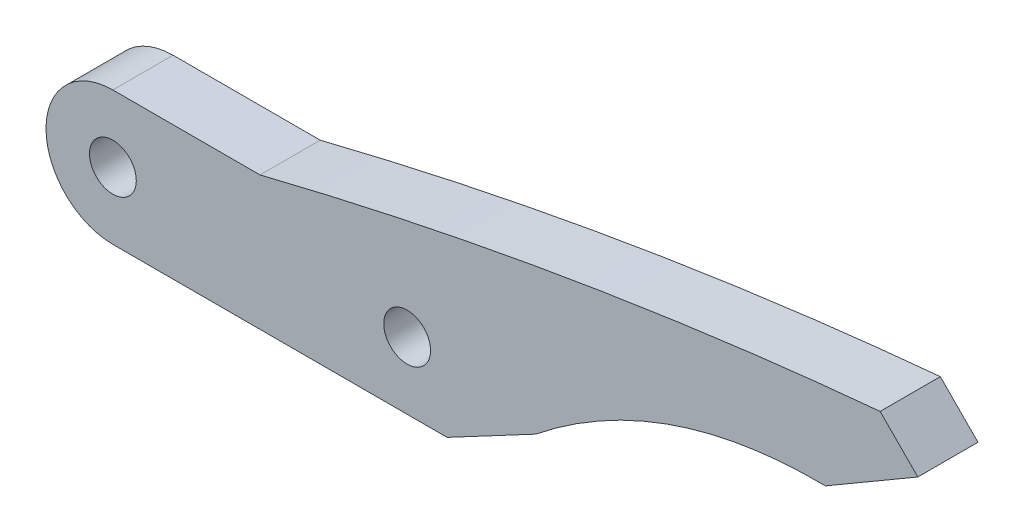
from build123d import *

# Parameters (mm, degrees)
SKETCH1_R           = 5
SKETCH1_R_2         = 1.75
BOSS_EXTRUDE1_DEPTH = 4.5
BOSS_EXTRUDE2_START = -4.5
BOSS_EXTRUDE2_DEPTH = 4.5


with BuildPart() as part:
    # Sketch1 → Boss-Extrude1 (new body)
    # profile 1 of 3: a face of its own
    with BuildSketch(Plane.XY):
        with Locations((-11, 0)):
            Circle(SKETCH1_R)
        with Locations((-11, 0)):
            Circle(SKETCH1_R_2, mode=Mode.SUBTRACT)
    # profile 2 of 3: a face of its own
    with BuildSketch(Plane.XY):
        with BuildLine():
            ThreePointArc((-6, 0), (-7.464466094, -3.535533906), (-11, -5))
            Line((-11, -5), (11, -5))
            ThreePointArc((11, -5), (6, 0), (11, 5))
            Line((11, 5), (-11, 5))
            ThreePointArc((-11, 5), (-7.464466094, 3.535533906), (-6, 0))
        make_face()
    # profile 3 of 3: a face of its own
    with BuildSketch(Plane.XY):
        with Locations((11, 0)):
            Circle(SKETCH1_R)
        with Locations((11, 0)):
            Circle(SKETCH1_R_2, mode=Mode.SUBTRACT)
    extrude(amount=BOSS_EXTRUDE1_DEPTH)

    # Sketch2 → Boss-Extrude2 (add)
    with BuildSketch(Plane.XY.offset(4.5).offset(BOSS_EXTRUDE2_START)):
        with BuildLine():
            Line((49.180795902, 10.03), (46.363989199, 12.87))
            add(Edge.make_bspline(
                [(0, 5), (22.885517501, 10.707926651), (46.363989199, 12.87)],
                knots=[0, 0, 0, 1, 1, 1], degree=2))
            Line((0, 5), (11, 5))
            ThreePointArc((11, 5), (16, 0), (11, -5))
            Line((11, -5), (13.99, -5))
            Line((13.99, -5), (20.61, -1.48))
            add(Edge.make_bspline(
                [(42.27, 6), (30.146150748, 6.157348305), (20.61, -1.48)],
                knots=[0, 0, 0, 1, 1, 1], degree=2))
            Line((42.27, 6), (49.180795902, 10.03))
        make_face()
    extrude(amount=BOSS_EXTRUDE2_DEPTH)


solid = part.part
